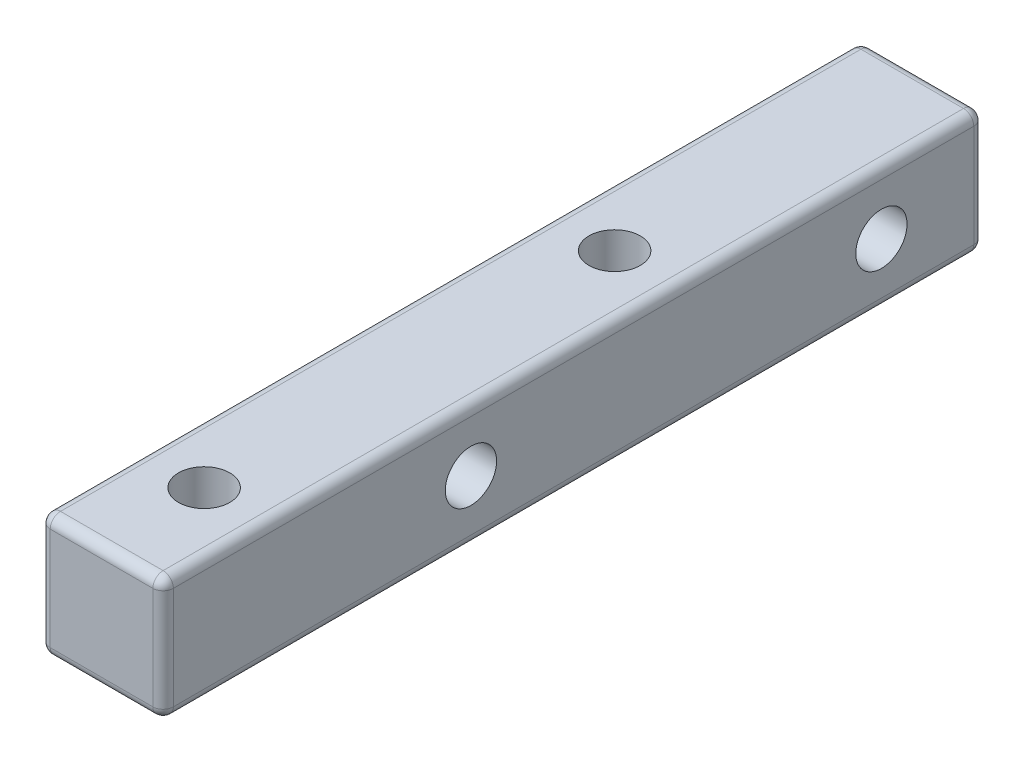
from build123d import *

# Parameters (mm, degrees)
SKETCH_1_W         = 6
SKETCH_1_H         = 6
EXTRUDE_1_DEPTH    = 40
HOLE_WIZARD_M3_1_D = 2.5
HOLE_WIZARD_M3_2_D = 2.5
FILLET_1_R         = 0.5


with BuildPart() as part:
    # 草图1 → 凸台-拉伸1 (new body)
    with BuildSketch(Plane.XY):
        Rectangle(SKETCH_1_W, SKETCH_1_H)
    extrude(amount=EXTRUDE_1_DEPTH)

    # M3 螺纹孔1 (through all)
    with Locations(Plane(origin=(0, 3, 0), x_dir=(1, 0, 0), z_dir=(0, 1, 0))):
        with Locations((0, -35), (0, -15)):
            Hole(HOLE_WIZARD_M3_1_D / 2)

    # M3 螺纹孔2 (through all)
    with Locations(Plane.ZY.offset(3)):
        with Locations((5, 0), (25, 0)):
            Hole(HOLE_WIZARD_M3_2_D / 2)

    # 圆角1
    fillet_1_edges = [part.edges().sort_by_distance(p)[0] for p in [
        (-3, 0, 40),
        (0, -3, 40),
        (3, 0, 40),
        (0, -3, 0),
        (-3, 0, 0),
        (0, 3, 0),
        (3, 0, 0),
        (0, 3, 40),
        (3, -3, 20),
        (-3, -3, 20),
        (-3, 3, 20),
        (3, 3, 20),
    ]]
    fillet(fillet_1_edges, radius=FILLET_1_R)


solid = part.part
